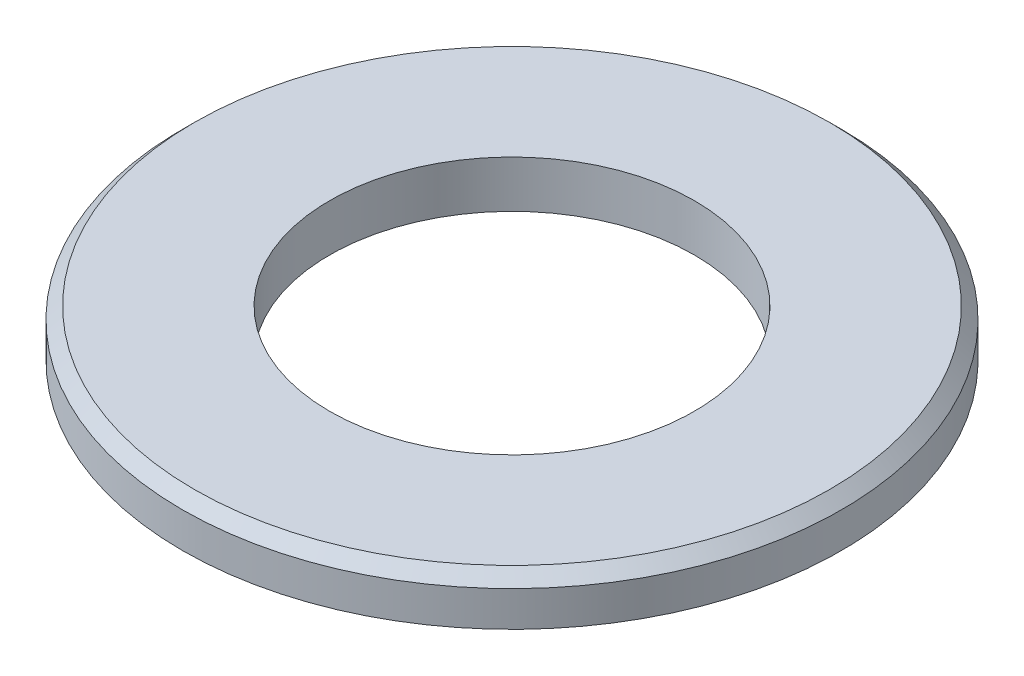
from build123d import *


with BuildPart() as part:
    # 草图1 → Revolve 484 (revolve)
    with BuildSketch(Plane.XY, mode=Mode.PRIVATE) as revolve_484_sk:
        Polygon((-27, 12.644507042), (-28, 11.644507042), (-28, 8.644507042), (-15.5, 8.644507042), (-15.5, 12.644507042), align=None)
    revolve(revolve_484_sk.sketch.rotate(Axis((0, 0, 0), (0, 1, 0)), 270), axis=Axis((0, 0, 0), (0, 1, 0)))


solid = part.part
